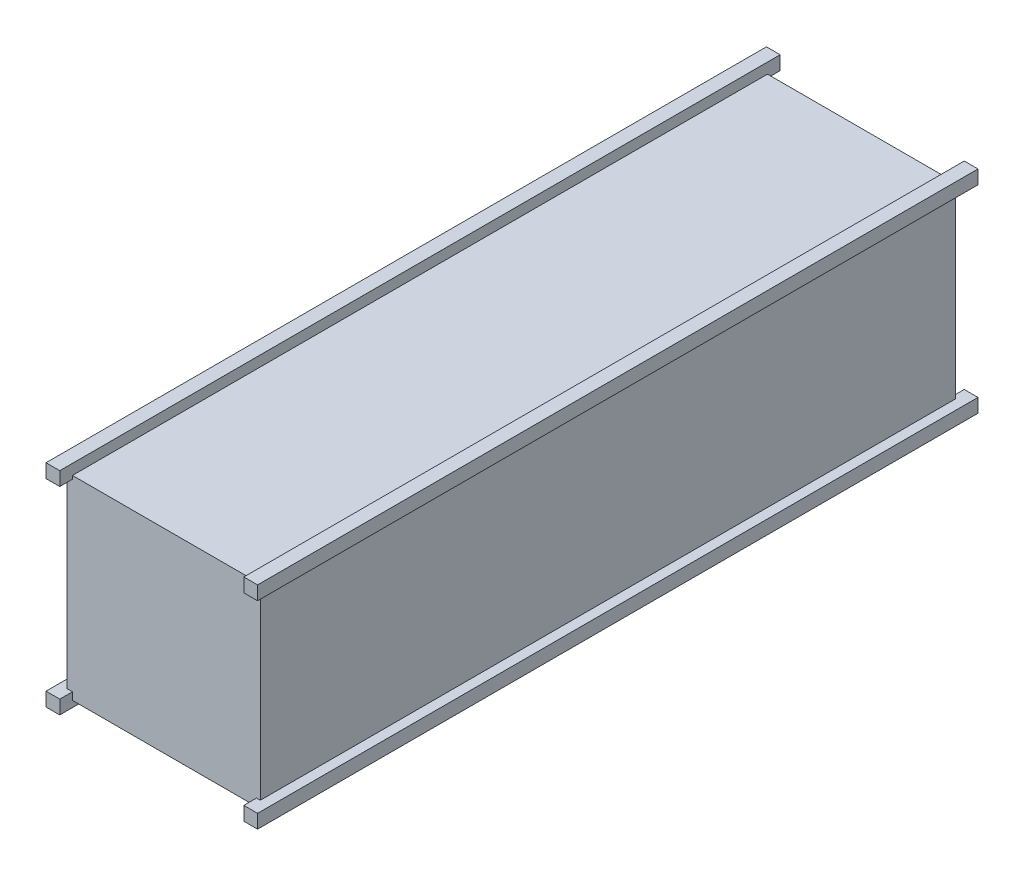
from build123d import *

# Parameters (mm, degrees)
SKETCH1_W             = 6.5
SKETCH1_H             = 6.5
BOSS_EXTRUDE1_DEPTH   = 340.5
BOSS_EXTRUDE1_2_DEPTH = 340.5
BOSS_EXTRUDE1_3_DEPTH = 340.5
BOSS_EXTRUDE1_4_DEPTH = 340.5
SKETCH2_W             = 91.305836421
SKETCH2_H             = 92.06883784
BOSS_EXTRUDE2_DEPTH   = 328.5


with BuildPart() as part:
    # Sketch1 → Boss-Extrude1 (new body)
    with BuildSketch(Plane.XY):
        with Locations((3.25, 96.75)):
            Rectangle(SKETCH1_W, SKETCH1_H)
    extrude(amount=-BOSS_EXTRUDE1_DEPTH)



with BuildPart() as body_2:
    # Sketch1 → Boss-Extrude1 2 (new body)
    with BuildSketch(Plane.XY):
        with Locations((96.75, 96.75)):
            Rectangle(SKETCH1_W, SKETCH1_H)
    extrude(amount=-BOSS_EXTRUDE1_2_DEPTH)


with BuildPart() as body_3:
    # Sketch1 → Boss-Extrude1 3 (new body)
    with BuildSketch(Plane.XY):
        with Locations((96.75, 3.25)):
            Rectangle(SKETCH1_W, SKETCH1_H)
    extrude(amount=-BOSS_EXTRUDE1_3_DEPTH)


with BuildPart() as body_4:
    # Sketch1 → Boss-Extrude1 4 (new body)
    with BuildSketch(Plane.XY):
        with Locations((3.25, 3.25)):
            Rectangle(SKETCH1_W, SKETCH1_H)
    extrude(amount=-BOSS_EXTRUDE1_4_DEPTH)


with BuildPart() as part_1:
    add(part.part)

    add(body_2.part)  # Boss-Extrude2 merges body 2

    add(body_3.part)  # Boss-Extrude2 merges body 3

    add(body_4.part)  # Boss-Extrude2 merges body 4
    # Sketch2 → Boss-Extrude2 (add)
    with BuildSketch(Plane(origin=(0, 0, -6), x_dir=(-1, 0, 0), z_dir=(0, 0, -1))):
        with Locations((-49.653832388, 49.017997872)):
            Rectangle(SKETCH2_W, SKETCH2_H)
    extrude(amount=BOSS_EXTRUDE2_DEPTH)


solid = part_1.part
